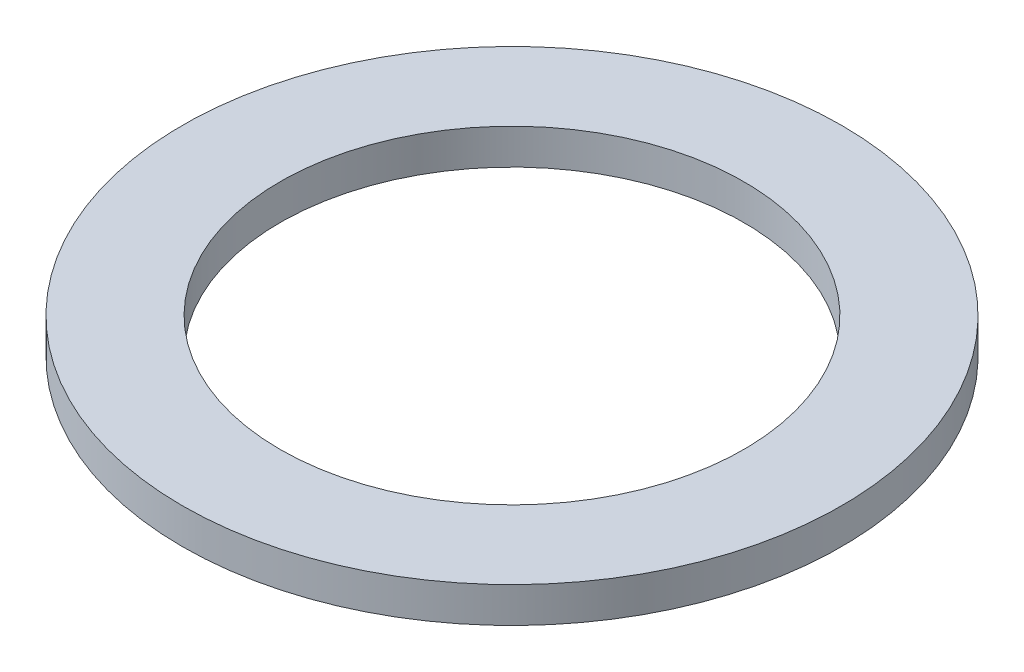
from build123d import *

# Parameters (mm, degrees)
SKETCH1_R           = 9.45
SKETCH1_R_2         = 6.65
BOSS_EXTRUDE2_DEPTH = 1.016


with BuildPart() as part:
    # Sketch1 → Boss-Extrude2 (new body)
    with BuildSketch(Plane(origin=(0, 0, 0), x_dir=(1, 0, 0), z_dir=(0, 1, 0))):
        with Locations(Location((0, 0, 0), (0, 0, 270))):
            Circle(SKETCH1_R)
        with Locations(Location((0, 0, 0), (0, 0, 270))):
            Circle(SKETCH1_R_2, mode=Mode.SUBTRACT)
    extrude(amount=BOSS_EXTRUDE2_DEPTH)


solid = part.part
